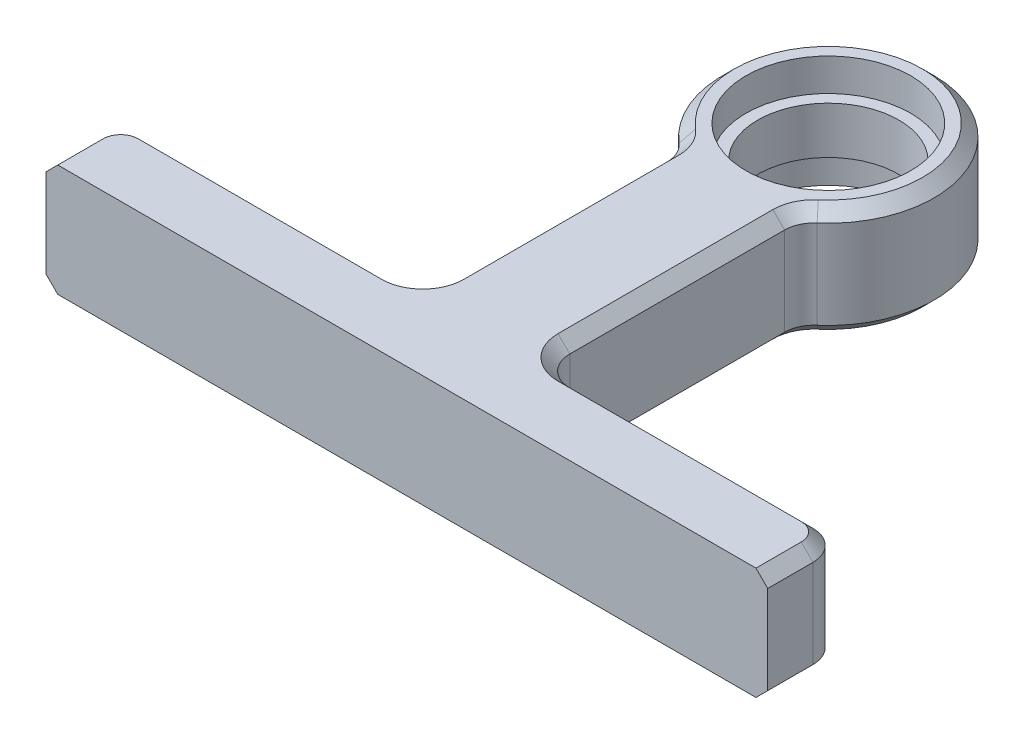
from build123d import *

# Parameters (mm, degrees)
SKETCH1_R           = 7
BOSS_EXTRUDE1_DEPTH = 4.7625
FILLET1_R           = 2.5
CHAMFER1_SIZE       = 1
SKETCH3_R           = 7
SKETCH3_R_2         = 6
BOSS_EXTRUDE2_DEPTH = 2


with BuildPart() as part:
    # Sketch1 → Boss-Extrude1 (new, symmetric)
    with BuildSketch(Plane(origin=(0, 0, 0), x_dir=(1, 0, 0), z_dir=(0, 1, 0))):
        with BuildLine():
            Line((-30.675, 0), (-30.675, 6.35))
            Line((-30.675, 6.35), (-5, 6.35))
            Line((-5, 6.35), (-5, 28.341685226))
            ThreePointArc((-5, 28.341685226), (0, 44.825), (5, 28.341685226))
            Line((5, 28.341685226), (5, 6.35))
            Line((5, 6.35), (30.675, 6.35))
            Line((30.675, 6.35), (30.675, 0))
            Line((30.675, 0), (-30.675, 0))
        make_face()
        with Locations(Location((0, 35.825, 0), (0, 0, 90))):
            Circle(SKETCH1_R, mode=Mode.SUBTRACT)
    extrude(amount=BOSS_EXTRUDE1_DEPTH, both=True)

    # Fillet1
    fillet1_edges = [part.edges().sort_by_distance(p)[0] for p in [
        (-30.675, 0, -6.35),
        (-5, 0, -6.35),
        (-5, 0, -28.341685226),
        (5, 0, -28.341685226),
        (5, 0, -6.35),
        (30.675, 0, -6.35),
    ]]
    fillet(fillet1_edges, radius=FILLET1_R)

    # Chamfer1
    chamfer1_edges = [part.edges().sort_by_distance(p)[0] for p in [
        (30.675, -4.7625, -1.925),
        (-5, -4.7625, -17.978601056),
        (-5, 4.7625, -17.978601056),
        (0, -4.7625, -44.825),
        (0, 4.7625, -44.825),
        (5, -4.7625, -17.978601056),
        (5, 4.7625, -17.978601056),
        (17.8375, -4.7625, -6.35),
        (17.8375, 4.7625, -6.35),
        (-30.675, -4.7625, -1.925),
        (-17.8375, -4.7625, -6.35),
        (-29.942766953, -4.7625, -5.617766953),
        (29.942766953, -4.7625, -5.617766953),
        (-17.8375, 4.7625, -6.35),
        (-30.675, 4.7625, -1.925),
        (-29.942766953, 4.7625, -5.617766953),
        (29.942766953, 4.7625, -5.617766953),
        (-5.227766852, -4.7625, -28.149774183),
        (-5.227766852, 4.7625, -28.149774183),
        (5.227766852, -4.7625, -28.149774183),
        (5.227766852, 4.7625, -28.149774183),
        (5.732233047, -4.7625, -7.082233047),
        (5.732233047, 4.7625, -7.082233047),
        (-5.732233047, -4.7625, -7.082233047),
        (-5.732233047, 4.7625, -7.082233047),
        (30.675, 4.7625, -1.925),
    ]]
    chamfer(chamfer1_edges, length=CHAMFER1_SIZE)

    # Sketch3 → Boss-Extrude2 (add, symmetric)
    with BuildSketch(Plane(origin=(0, 0, 0), x_dir=(1, 0, 0), z_dir=(0, 1, 0))):
        with Locations(Location((0, 35.825, 0), (0, 0, 90))):
            Circle(SKETCH3_R)
        with Locations(Location((0, 35.825, 0), (0, 0, 270))):
            Circle(SKETCH3_R_2, mode=Mode.SUBTRACT)
    extrude(amount=BOSS_EXTRUDE2_DEPTH, both=True)


solid = part.part
